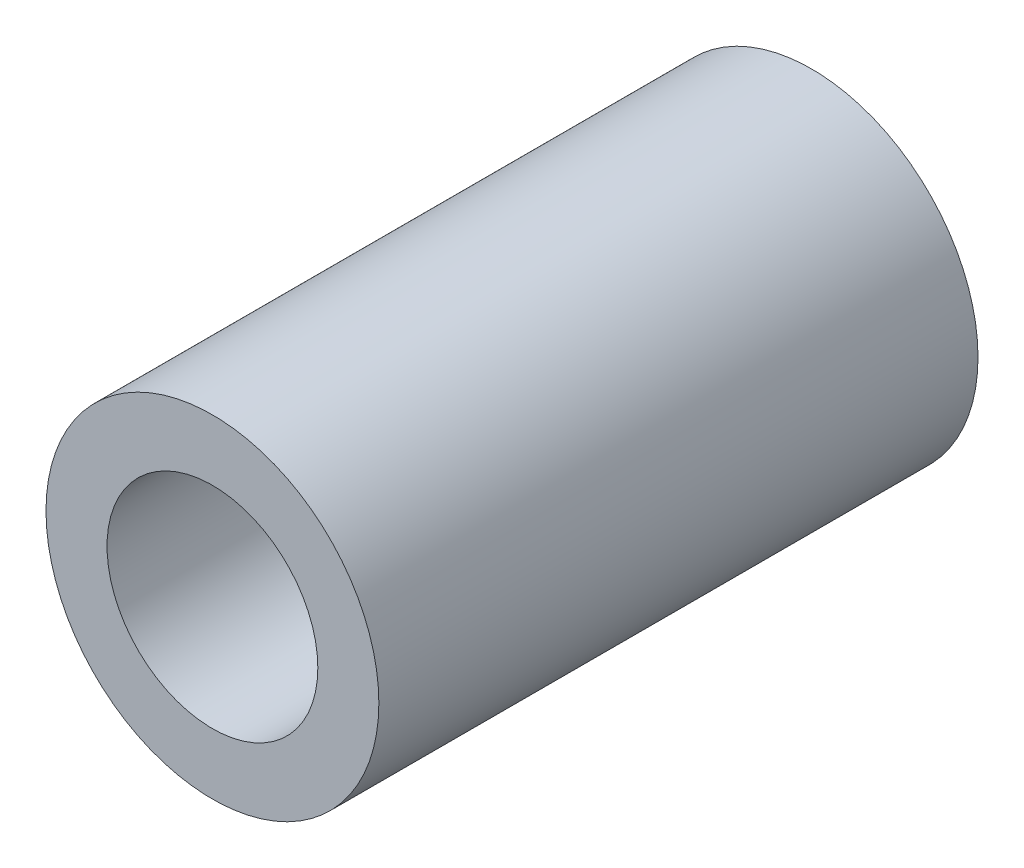
from build123d import *

# Parameters (mm, degrees)
ESQUISSE1_R        = 7.5
ESQUISSE1_R_2      = 4.75
BOSS_EXTRU_1_DEPTH = 27


with BuildPart() as part:
    # Esquisse1 → Boss.-Extru.1 (new body)
    with BuildSketch(Plane.XY):
        Circle(ESQUISSE1_R)
        Circle(ESQUISSE1_R_2, mode=Mode.SUBTRACT)
    extrude(amount=BOSS_EXTRU_1_DEPTH)


solid = part.part
